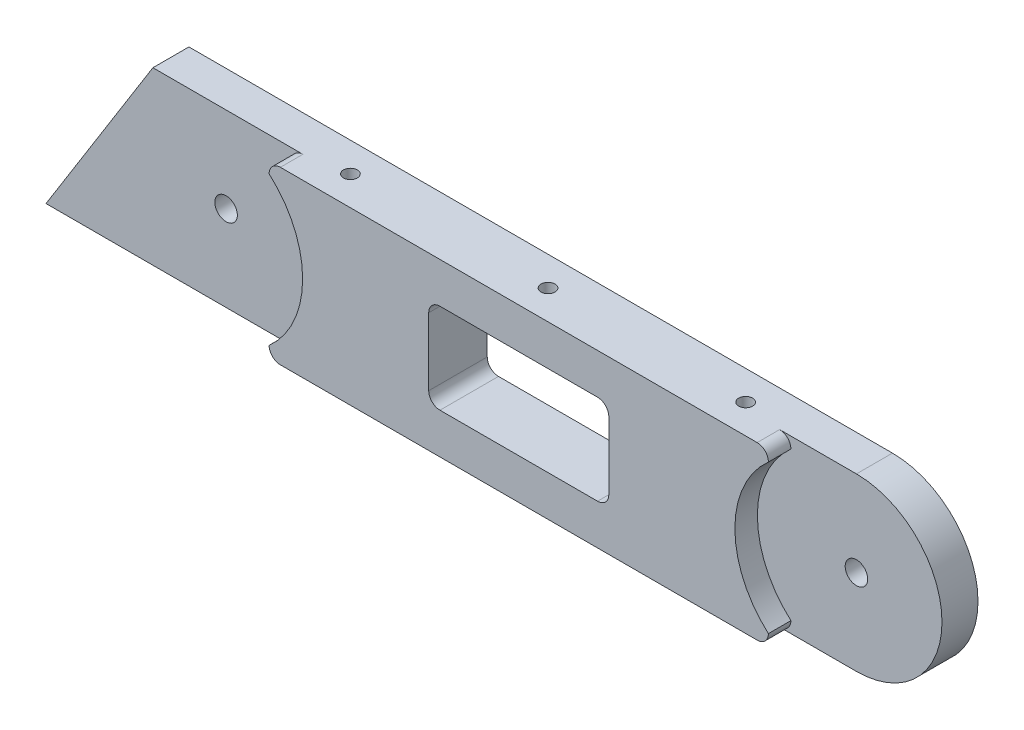
from build123d import *

# Parameters (mm, degrees)
SKETCH1_R           = 2.5
BOSS_EXTRUDE3_DEPTH = 8
BOSS_EXTRUDE7_DEPTH = 5
CUT_EXTRUDE1_DEPTH  = 112.404667766
SKETCH18_R          = 1.55
CUT_EXTRUDE2_DEPTH  = 6
CUT_EXTRUDE3_START  = -6
SKETCH19_R          = 1.55
CUT_EXTRUDE3_DEPTH  = 6
SKETCH21_R          = 22
CUT_EXTRUDE5_DEPTH  = 5


with BuildPart() as part:
    # Sketch1 → Boss-Extrude3 (new body)
    # profile 1 of 5: a face of its own
    with BuildSketch(Plane.XY):
        with BuildLine():
            Line((-66.254964627, 19), (-90, -19))
            Line((-90, -19), (90, -19))
            ThreePointArc((90, -19), (71, 0), (90, 19))
            Line((90, 19), (-66.254964627, 19))
        make_face()
        with Locations((-50, 0)):
            Circle(SKETCH1_R, mode=Mode.SUBTRACT)
        with BuildLine():
            ThreePointArc((40, -7.5), (39.267766953, -9.267766953), (37.5, -10))
            Line((37.5, -10), (2.5, -10))
            ThreePointArc((2.5, -10), (0.732233047, -9.267766953), (0, -7.5))
            Line((0, -7.5), (0, 7.5))
            ThreePointArc((0, 7.5), (0.732233047, 9.267766953), (2.5, 10))
            Line((2.5, 10), (37.5, 10))
            ThreePointArc((37.5, 10), (39.267766953, 9.267766953), (40, 7.5))
            Line((40, 7.5), (40, -7.5))
        make_face(mode=Mode.SUBTRACT)
    # profile 2 of 5: a face of its own
    with BuildSketch(Plane.XY):
        with BuildLine():
            ThreePointArc((90, 19), (71, 0), (90, -19))
            Line((90, -19), (90, -2.5))
            ThreePointArc((90, -2.5), (87.5, 0), (90, 2.5))
            Line((90, 2.5), (90, 19))
        make_face()
    # profile 3 of 5: a face of its own
    with BuildSketch(Plane.XY):
        with BuildLine():
            Line((90, -2.5), (90, -19))
            ThreePointArc((90, -19), (103.435028843, -13.435028843), (109, 0))
            ThreePointArc((109, 0), (103.435028843, 13.435028843), (90, 19))
            Line((90, 19), (90, 2.5))
            ThreePointArc((90, 2.5), (91.767766953, 1.767766953), (92.5, 0))
            ThreePointArc((92.5, 0), (91.767766953, -1.767766953), (90, -2.5))
        make_face()
    # profile 4 of 5: a face of its own
    with BuildSketch(Plane.XY):
        with BuildLine():
            ThreePointArc((90, 19), (71, 0), (90, -19))
            Line((90, -19), (90, -2.5))
            ThreePointArc((90, -2.5), (87.5, 0), (90, 2.5))
            Line((90, 2.5), (90, 19))
        make_face()
    # profile 5 of 5: a face of its own
    with BuildSketch(Plane.XY):
        with BuildLine():
            Line((90, -2.5), (90, -19))
            ThreePointArc((90, -19), (103.435028843, -13.435028843), (109, 0))
            ThreePointArc((109, 0), (103.435028843, 13.435028843), (90, 19))
            Line((90, 19), (90, 2.5))
            ThreePointArc((90, 2.5), (91.767766953, 1.767766953), (92.5, 0))
            ThreePointArc((92.5, 0), (91.767766953, -1.767766953), (90, -2.5))
        make_face()
    extrude(amount=BOSS_EXTRUDE3_DEPTH)

    # Sketch3 → Boss-Extrude7 (add)
    with BuildSketch(Plane.XY.offset(8)):
        with BuildLine():
            Line((-32.948367789, 19), (72.948367789, 19))
            ThreePointArc((72.948367789, 19), (74.716134742, 18.267766953), (75.448367789, 16.5))
            Line((75.448367789, 16.5), (75.448367789, -16.5))
            ThreePointArc((75.448367789, -16.5), (74.716134742, -18.267766953), (72.948367789, -19))
            Line((72.948367789, -19), (-32.948367789, -19))
            ThreePointArc((-32.948367789, -19), (-34.716134742, -18.267766953), (-35.448367789, -16.5))
            Line((-35.448367789, -16.5), (-35.448367789, 16.5))
            ThreePointArc((-35.448367789, 16.5), (-34.716134742, 18.267766953), (-32.948367789, 19))
        make_face()
    extrude(amount=BOSS_EXTRUDE7_DEPTH)

    # Sketch14 → Cut-Extrude1 (cut, through all)
    with BuildSketch(Plane.XY.offset(13)):
        with BuildLine():
            Line((2.5, -10), (37.5, -10))
            ThreePointArc((37.5, -10), (39.267766953, -9.267766953), (40, -7.5))
            Line((40, -7.5), (40, 7.5))
            ThreePointArc((40, 7.5), (39.267766953, 9.267766953), (37.5, 10))
            Line((37.5, 10), (2.5, 10))
            ThreePointArc((2.5, 10), (0.732233047, 9.267766953), (0, 7.5))
            Line((0, 7.5), (0, -7.5))
            ThreePointArc((0, -7.5), (0.732233047, -9.267766953), (2.5, -10))
        make_face()
    extrude(amount=-CUT_EXTRUDE1_DEPTH, mode=Mode.SUBTRACT)

    # Sketch18 → Cut-Extrude2 (cut)
    with BuildSketch(Plane.XZ.offset(19)):
        with Locations((-23.89, 6.5)):
            Circle(SKETCH18_R)
        with Locations((20, 6.5)):
            Circle(SKETCH18_R)
        with Locations((63.89, 6.5)):
            Circle(SKETCH18_R)
    extrude(amount=-CUT_EXTRUDE2_DEPTH, mode=Mode.SUBTRACT)

    # Sketch19 → Cut-Extrude3 (cut)
    with BuildSketch(Plane(origin=(0, 19, 0), x_dir=(1, 0, 0), z_dir=(0, 1, 0)).offset(CUT_EXTRUDE3_START)):
        with Locations((-23.89, -6.5)):
            Circle(SKETCH19_R)
        with Locations((20, -6.5)):
            Circle(SKETCH19_R)
        with Locations((63.89, -6.5)):
            Circle(SKETCH19_R)
    extrude(amount=CUT_EXTRUDE3_DEPTH, mode=Mode.SUBTRACT)

    # Sketch21 → Cut-Extrude5 (cut)
    with BuildSketch(Plane.XY.offset(13)):
        with Locations((-50, 0)):
            Circle(SKETCH21_R)
        with Locations((90, 0)):
            Circle(SKETCH21_R)
    extrude(amount=-CUT_EXTRUDE5_DEPTH, mode=Mode.SUBTRACT)


solid = part.part
